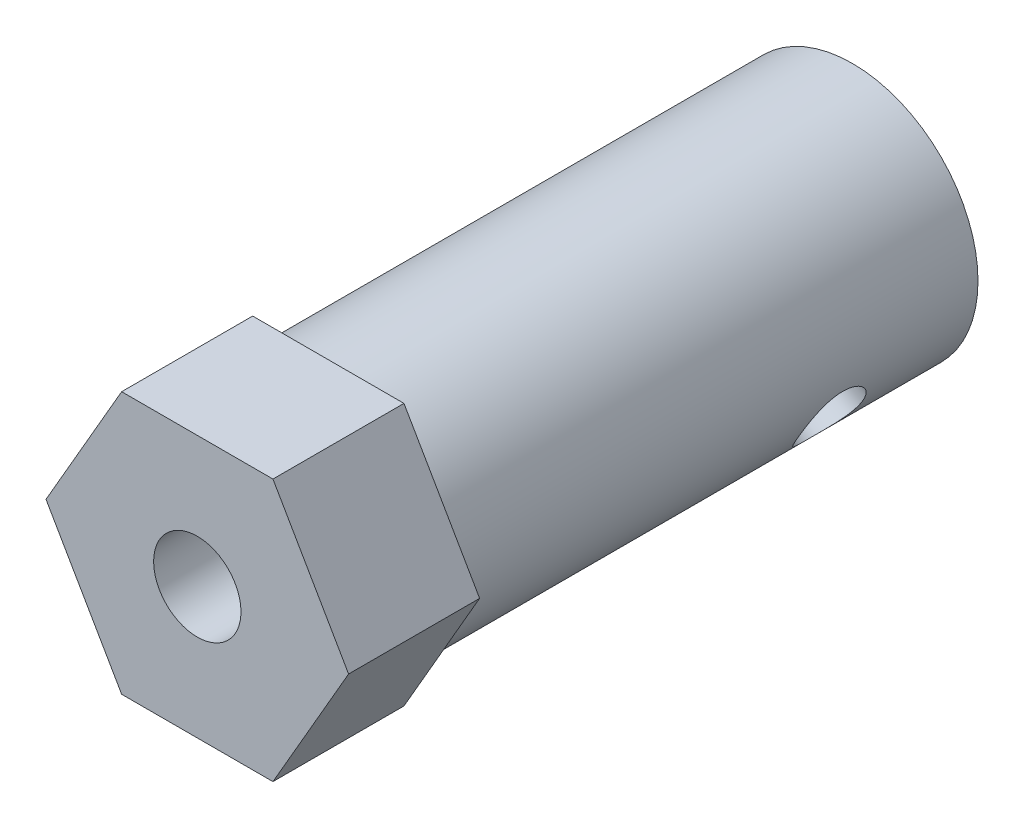
from build123d import *

# Parameters (mm, degrees)
BOSS_EXTRUDE1_DEPTH = 6
SKETCH2_R           = 5.75
BOSS_EXTRUDE2_DEPTH = 24
SKETCH4_R           = 2
CUT_EXTRUDE2_DEPTH  = 32.368774283
SKETCH5_R           = 1.5
CUT_EXTRUDE3_DEPTH  = 6


with BuildPart() as part:
    # Sketch1 → Boss-Extrude1 (new body)
    with BuildSketch(Plane(origin=(0, 0, 0), x_dir=(0, 1, 0), z_dir=(0, 0, 1))):
        Polygon((0, 6.92820323), (-6, 3.464101615), (-6, -3.464101615), (0, -6.92820323), (6, -3.464101615), (6, 3.464101615), align=None)
    extrude(amount=BOSS_EXTRUDE1_DEPTH)

    # Sketch2 → Boss-Extrude2 (add)
    with BuildSketch(Plane(origin=(0, 0, 0), x_dir=(1, 0, 0), z_dir=(0, 0, -1))):
        with Locations(Location((0, 0, 0), (0, 0, 180))):
            Circle(SKETCH2_R)
    extrude(amount=BOSS_EXTRUDE2_DEPTH)

    # Sketch4 → Cut-Extrude2 (cut, through all)
    with BuildSketch(Plane(origin=(0, 0, -24), x_dir=(1, 0, 0), z_dir=(0, 0, -1))):
        with Locations(Location((0, 0, 0), (0, 0, 180))):
            Circle(SKETCH4_R)
    extrude(amount=-CUT_EXTRUDE2_DEPTH, mode=Mode.SUBTRACT)

    # Sketch5 → Cut-Extrude3 (cut)
    with BuildSketch(Plane(origin=(5.196152423, -3, 0), x_dir=(0.49999999999999506, 0.8660254037844415, 0), z_dir=(0.8660254037844415, -0.49999999999999506, 0))):
        with Locations((0, -18)):
            Circle(SKETCH5_R)
    extrude(amount=-CUT_EXTRUDE3_DEPTH, mode=Mode.SUBTRACT)


solid = part.part
